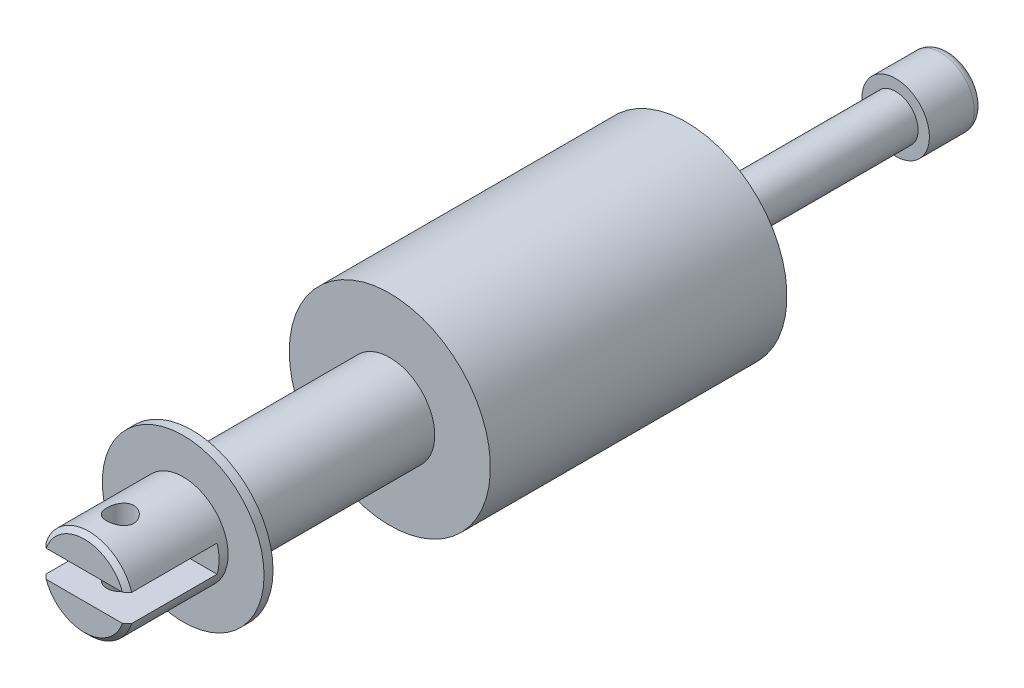
from build123d import *

# Parameters (mm, degrees)
CHAMFER_1_SIZE      = 0.5
SKETCH_3_W          = 16
SKETCH_3_H          = 3
CUT_EXTRUDE_1_DEPTH = 10
SKETCH_4_R          = 1.5
CUT_EXTRUDE_2_DEPTH = 11
FILLET_1_R          = 1
SKETCH_5_R          = 9
EXTRUDE_1_DEPTH     = 1


with BuildPart() as part:
    # 草图1 → 旋转1 (revolve)
    with BuildSketch(Plane(origin=(0, 0, 0), x_dir=(1, 0, 0), z_dir=(0, 1, 0)), mode=Mode.PRIVATE) as revolve_1_sk:
        Polygon((2.5, 14.928900778), (2.5, -8.371099222), (11.195443228, -8.371099222), (11.195443228, -41.371099222), (5, -41.371099222), (5, -75.371099222), (0, -75.371099222), (0, 20.928900778), (2.5, 20.928900778), (3.75, 20.928900778), (3.75, 14.928900778), align=None)
    revolve(revolve_1_sk.sketch.rotate(Axis((0, 0, -46.113181398), (0, 0, 1)), 180), axis=Axis((0, 0, -46.113181398), (0, 0, 1)))

    # 倒角1
    chamfer_1_edges = [part.edges().sort_by_distance(p)[0] for p in [
        (5, 0, 75.371099222),
    ]]
    chamfer(chamfer_1_edges, length=CHAMFER_1_SIZE)

    # 草图3 → 切除-拉伸1 (cut)
    with BuildSketch(Plane.XY.offset(75.371099222)):
        Rectangle(SKETCH_3_W, SKETCH_3_H)
    extrude(amount=-CUT_EXTRUDE_1_DEPTH, mode=Mode.SUBTRACT)

    # 草图4 → 切除-拉伸2 (cut, symmetric)
    with BuildSketch(Plane(origin=(0, 0, 0), x_dir=(1, 0, 0), z_dir=(0, 1, 0))):
        with Locations(Location((0, -71.371099222, 0), (0, 0, 90))):
            Circle(SKETCH_4_R)
    extrude(amount=CUT_EXTRUDE_2_DEPTH, both=True, mode=Mode.SUBTRACT)

    # 圆角1
    fillet_1_edges = [part.edges().sort_by_distance(p)[0] for p in [
        (3.75, 0, -20.928900778),
    ]]
    fillet(fillet_1_edges, radius=FILLET_1_R)

    # 草图5 → 凸台-拉伸1 (add)
    with BuildSketch(Plane.XY.offset(64.371099222)):
        Circle(SKETCH_5_R)
    extrude(amount=-EXTRUDE_1_DEPTH)


solid = part.part
